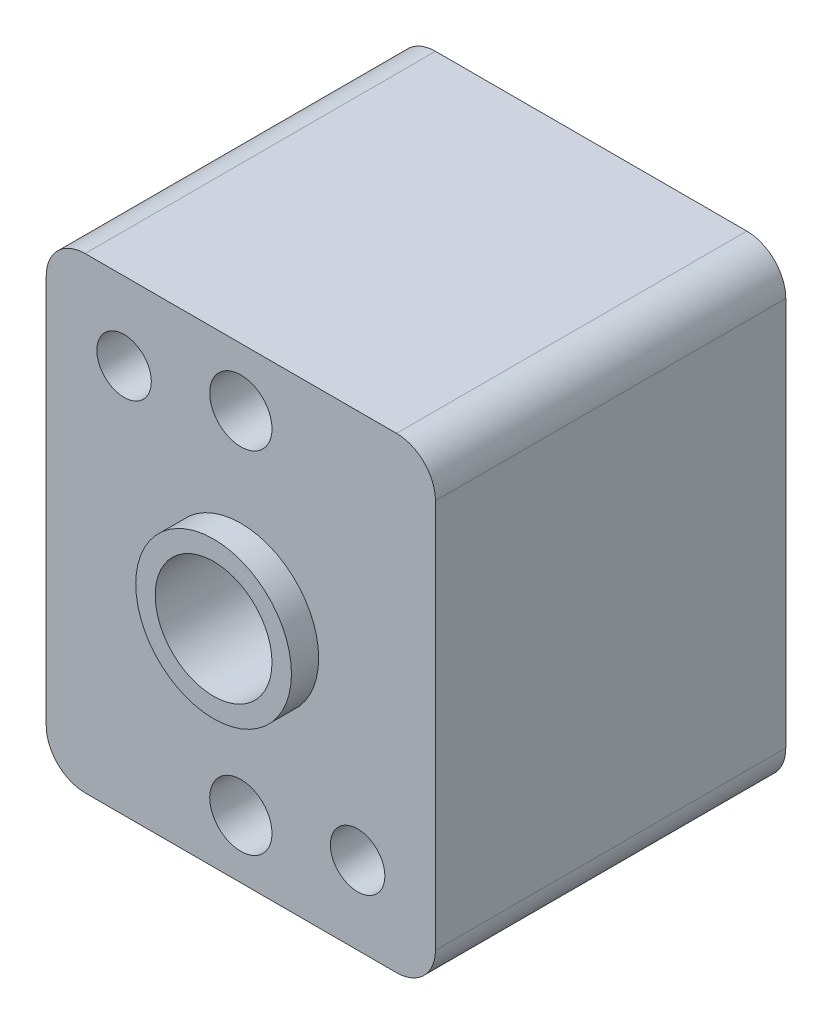
from build123d import *

# Parameters (mm, degrees)
SKETCH_1_W      = 10
SKETCH_1_H      = 12
SKETCH_1_R      = 1.5
SKETCH_1_R_2    = 0.8
SKETCH_1_R_3    = 0.7
EXTRUDE_1_DEPTH = 9
SKETCH_2_R      = 2
SKETCH_2_R_2    = 1.5
EXTRUDE_2_DEPTH = 0.7
FILLET_1_R      = 1


with BuildPart() as part:
    # 草图1 → 凸台-拉伸1 (new body)
    with BuildSketch(Plane.XY):
        Rectangle(SKETCH_1_W, SKETCH_1_H)
        Circle(SKETCH_1_R, mode=Mode.SUBTRACT)
        with Locations((0, 4.5)):
            Circle(SKETCH_1_R_2, mode=Mode.SUBTRACT)
        with Locations(Location((0, -4.5, 0), (0, 0, 180))):
            Circle(SKETCH_1_R_2, mode=Mode.SUBTRACT)
        with Locations((-3, 4)):
            Circle(SKETCH_1_R_3, mode=Mode.SUBTRACT)
        with Locations((3, -4)):
            Circle(SKETCH_1_R_3, mode=Mode.SUBTRACT)
    extrude(amount=EXTRUDE_1_DEPTH)

    # 草图2 → 凸台-拉伸2 (add)
    with BuildSketch(Plane.XY.offset(9)):
        with Locations(Location((0, 0, 0), (0, 0, 180))):
            Circle(SKETCH_2_R)
        Circle(SKETCH_2_R_2, mode=Mode.SUBTRACT)
    extrude(amount=EXTRUDE_2_DEPTH)

    # 圆角1
    fillet_1_edges = [part.edges().sort_by_distance(p)[0] for p in [
        (5, -6, 4.5),
        (-5, -6, 4.5),
        (-5, 6, 4.5),
        (5, 6, 4.5),
    ]]
    fillet(fillet_1_edges, radius=FILLET_1_R)


solid = part.part
